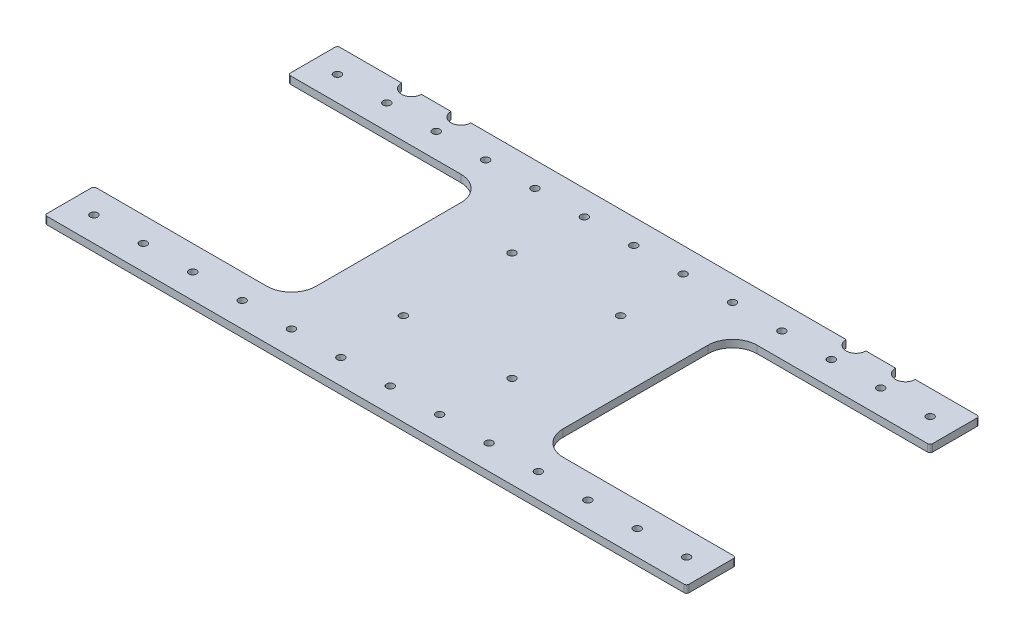
from build123d import *

# Parameters (mm, degrees)
EXTRUDE_1_DEPTH     = 3
CUT_EXTRUDE_START   = -10
CUT_EXTRUDE_1_DEPTH = 10
SKETCH_3_W          = 20
SKETCH_3_H          = 40
EXTRUDE_2_DEPTH     = 3
FILLET_2_R          = 1
FILLET_3_R          = 1
SKETCH_5_R          = 1.5
CUT_EXTRUDE_2_DEPTH = 10
SKETCH_6_R          = 1.5
CUT_EXTRUDE_3_DEPTH = 10
SKETCH_8_R          = 1.5
CUT_EXTRUDE_4_DEPTH = 234.216551728
SKETCH_10_R         = 4
CUT_EXTRUDE_6_DEPTH = 234.216551728
SKETCH_11_W         = 40.88
SKETCH_11_H         = 149.99999794
CUT_EXTRUDE_7_DEPTH = 10
SKETCH_12_W         = 75.865569995
SKETCH_12_H         = 55.877442545
CUT_EXTRUDE_8_DEPTH = 10


with BuildPart() as part:
    # 草图1 → 凸台-拉伸1 (new body)
    with BuildSketch(Plane(origin=(0, 0, 0), x_dir=(1, 0, 0), z_dir=(0, 1, 0))):
        with BuildLine():
            Line((-130, -193.6), (-50, -193.6))
            Line((-50, -193.6), (50, -193.6))
            Line((50, -193.6), (130, -193.6))
            Line((130, -193.6), (130, -173.6))
            Line((130, -173.6), (60, -173.6))
            ThreePointArc((60, -173.6), (52.928932188, -170.671067812), (50, -163.6))
            Line((50, -163.6), (50, -105))
            ThreePointArc((50, -105), (52.928932188, -97.928932188), (60, -95))
            Line((60, -95), (130, -95))
            Line((130, -95), (130, -75))
            Line((130, -75), (130, 75))
            Line((130, 75), (130, 95))
            Line((130, 95), (60, 95))
            ThreePointArc((60, 95), (52.928932188, 97.928932188), (50, 105))
            Line((50, 105), (50, 163.6))
            ThreePointArc((50, 163.6), (52.928932188, 170.671067812), (60, 173.6))
            Line((60, 173.6), (130, 173.6))
            Line((130, 173.6), (130, 193.6))
            Line((130, 193.6), (50, 193.6))
            Line((50, 193.6), (-50, 193.6))
            Line((-50, 193.6), (-130, 193.6))
            Line((-130, 193.6), (-130, 173.6))
            Line((-130, 173.6), (-60, 173.6))
            ThreePointArc((-60, 173.6), (-52.928932188, 170.671067812), (-50, 163.6))
            Line((-50, 163.6), (-50, 105))
            ThreePointArc((-50, 105), (-52.928932188, 97.928932188), (-60, 95))
            Line((-60, 95), (-130, 95))
            Line((-130, 95), (-130, 75))
            Line((-130, 75), (-130, -75))
            Line((-130, -75), (-130, -95))
            Line((-130, -95), (-60, -95))
            ThreePointArc((-60, -95), (-52.928932188, -97.928932188), (-50, -105))
            Line((-50, -105), (-50, -163.6))
            ThreePointArc((-50, -163.6), (-52.928932188, -170.671067812), (-60, -173.6))
            Line((-60, -173.6), (-130, -173.6))
            Line((-130, -173.6), (-130, -193.6))
        make_face()
    extrude(amount=EXTRUDE_1_DEPTH)

    # 草图2 → 切除-拉伸1 (cut)
    with BuildSketch(Plane(origin=(0, 3, 0), x_dir=(1, 0, 0), z_dir=(0, 1, 0)).offset(CUT_EXTRUDE_START)):
        with BuildLine():
            Line((-130, 95), (-130, -75))
            Line((-130, -75), (130, -75))
            Line((130, -75), (130, 95))
            Line((130, 95), (60, 95))
            ThreePointArc((60, 95), (52.928932188, 97.928932188), (50, 105))
            Line((50, 105), (50, 163.6))
            ThreePointArc((50, 163.6), (52.928932188, 170.671067812), (60, 173.6))
            Line((60, 173.6), (130, 173.6))
            Line((130, 173.6), (130, 193.6))
            Line((130, 193.6), (-130, 193.6))
            Line((-130, 193.6), (-130, 173.6))
            Line((-130, 173.6), (-60, 173.6))
            ThreePointArc((-60, 173.6), (-52.928932188, 170.671067812), (-50, 163.6))
            Line((-50, 163.6), (-50, 105))
            ThreePointArc((-50, 105), (-52.928932188, 97.928932188), (-60, 95))
            Line((-60, 95), (-130, 95))
        make_face()
    extrude(amount=CUT_EXTRUDE_1_DEPTH, mode=Mode.SUBTRACT)

    # 草图3 → 凸台-拉伸2 (add)
    with BuildSketch(Plane(origin=(0, 3, 0), x_dir=(1, 0, 0), z_dir=(0, 1, 0))):
        with Locations((90, -55)):
            Rectangle(SKETCH_3_W, SKETCH_3_H)
        with Locations((-90, -55)):
            Rectangle(SKETCH_3_W, SKETCH_3_H)
    extrude(amount=-EXTRUDE_2_DEPTH)

    # 圆角2
    fillet_2_edges = [part.edges().sort_by_distance(p)[0] for p in [
        (-130, 1.5, 75),
        (-100, 1.5, 35),
        (-80, 1.5, 35),
        (-130, 1.5, 193.6),
        (-130, 1.5, 173.6),
        (-130, 1.5, 95),
    ]]
    fillet(fillet_2_edges, radius=FILLET_2_R)

    # 圆角3
    fillet_3_edges = [part.edges().sort_by_distance(p)[0] for p in [
        (130, 1.5, 75),
        (80, 1.5, 35),
        (100, 1.5, 35),
        (130, 1.5, 95),
        (130, 1.5, 173.6),
        (130, 1.5, 193.6),
    ]]
    fillet(fillet_3_edges, radius=FILLET_3_R)

    # 草图5 → 切除-拉伸2 (cut)
    with BuildSketch(Plane(origin=(0, 3, 0), x_dir=(1, 0, 0), z_dir=(0, 1, 0))):
        with Locations(Location((22, -112.3, 0), (0, 0, 270))):
            Circle(SKETCH_5_R)
        with Locations(Location((-22, -112.3, 0), (0, 0, 270))):
            Circle(SKETCH_5_R)
        with Locations(Location((-22, -156.3, 0), (0, 0, 270))):
            Circle(SKETCH_5_R)
        with Locations(Location((22, -156.3, 0), (0, 0, 270))):
            Circle(SKETCH_5_R)
    extrude(amount=-CUT_EXTRUDE_2_DEPTH, mode=Mode.SUBTRACT)

    # 草图6 → 切除-拉伸3 (cut)
    with BuildSketch(Plane(origin=(0, 3, 0), x_dir=(1, 0, 0), z_dir=(0, 1, 0))):
        with Locations(Location((120, -85, 0), (0, 0, 270))):
            Circle(SKETCH_6_R)
        with Locations(Location((80, -85, 0), (0, 0, 270))):
            Circle(SKETCH_6_R)
        with Locations(Location((100, -85, 0), (0, 0, 270))):
            Circle(SKETCH_6_R)
        with Locations(Location((60, -85, 0), (0, 0, 270))):
            Circle(SKETCH_6_R)
        with Locations(Location((40, -85, 0), (0, 0, 270))):
            Circle(SKETCH_6_R)
        with Locations(Location((20, -85, 0), (0, 0, 270))):
            Circle(SKETCH_6_R)
        with Locations(Location((0, -85, 0), (0, 0, 270))):
            Circle(SKETCH_6_R)
        with Locations(Location((-20, -85, 0), (0, 0, 270))):
            Circle(SKETCH_6_R)
        with Locations(Location((-40, -85, 0), (0, 0, 270))):
            Circle(SKETCH_6_R)
        with Locations(Location((-60, -85, 0), (0, 0, 270))):
            Circle(SKETCH_6_R)
        with Locations(Location((-80, -85, 0), (0, 0, 270))):
            Circle(SKETCH_6_R)
        with Locations(Location((-100, -85, 0), (0, 0, 270))):
            Circle(SKETCH_6_R)
        with Locations(Location((-120, -85, 0), (0, 0, 270))):
            Circle(SKETCH_6_R)
        with Locations(Location((-100, -183.6, 0), (0, 0, 270))):
            Circle(SKETCH_6_R)
        with Locations(Location((-120, -183.6, 0), (0, 0, 270))):
            Circle(SKETCH_6_R)
        with Locations(Location((-80, -183.6, 0), (0, 0, 270))):
            Circle(SKETCH_6_R)
        with Locations(Location((-60, -183.6, 0), (0, 0, 270))):
            Circle(SKETCH_6_R)
        with Locations(Location((-40, -183.6, 0), (0, 0, 270))):
            Circle(SKETCH_6_R)
        with Locations(Location((-20, -183.6, 0), (0, 0, 270))):
            Circle(SKETCH_6_R)
        with Locations(Location((0, -183.6, 0), (0, 0, 270))):
            Circle(SKETCH_6_R)
        with Locations(Location((20, -183.6, 0), (0, 0, 270))):
            Circle(SKETCH_6_R)
        with Locations(Location((40, -183.6, 0), (0, 0, 270))):
            Circle(SKETCH_6_R)
        with Locations(Location((60, -183.6, 0), (0, 0, 270))):
            Circle(SKETCH_6_R)
        with Locations(Location((80, -183.6, 0), (0, 0, 270))):
            Circle(SKETCH_6_R)
        with Locations(Location((100, -183.6, 0), (0, 0, 270))):
            Circle(SKETCH_6_R)
        with Locations(Location((120, -183.6, 0), (0, 0, 270))):
            Circle(SKETCH_6_R)
    extrude(amount=-CUT_EXTRUDE_3_DEPTH, mode=Mode.SUBTRACT)

    # 草图8 → 切除-拉伸4 (cut, through all)
    with BuildSketch(Plane.XZ):
        with Locations(Location((-90, 40, 0), (0, 0, 270))):
            Circle(SKETCH_8_R)
        with Locations(Location((-90, 60, 0), (0, 0, 270))):
            Circle(SKETCH_8_R)
        with Locations(Location((90, 60, 0), (0, 0, 270))):
            Circle(SKETCH_8_R)
        with Locations(Location((90, 40, 0), (0, 0, 270))):
            Circle(SKETCH_8_R)
    extrude(amount=-CUT_EXTRUDE_4_DEPTH, mode=Mode.SUBTRACT)

    # 草图10 → 切除-拉伸6 (cut, through all)
    with BuildSketch(Plane(origin=(0, 3, 0), x_dir=(1, 0, 0), z_dir=(0, 1, 0))):
        with Locations((-100, -75)):
            Circle(SKETCH_10_R)
        with Locations((-80, -75)):
            Circle(SKETCH_10_R)
        with Locations((80, -75)):
            Circle(SKETCH_10_R)
        with Locations((100, -75)):
            Circle(SKETCH_10_R)
    extrude(amount=-CUT_EXTRUDE_6_DEPTH, mode=Mode.SUBTRACT)

    # 草图11 → 切除-拉伸7 (cut)
    with BuildSketch(Plane(origin=(0, 3, 0), x_dir=(1, 0, 0), z_dir=(0, 1, 0))):
        with Locations((-98.325151621, -1.03e-06)):
            Rectangle(SKETCH_11_W, SKETCH_11_H)
    extrude(amount=-CUT_EXTRUDE_7_DEPTH, mode=Mode.SUBTRACT)

    # 草图12 → 切除-拉伸8 (cut)
    with BuildSketch(Plane(origin=(0, 3, 0), x_dir=(1, 0, 0), z_dir=(0, 1, 0))):
        with Locations((78.567215003, -47.061278728)):
            Rectangle(SKETCH_12_W, SKETCH_12_H)
    extrude(amount=-CUT_EXTRUDE_8_DEPTH, mode=Mode.SUBTRACT)


solid = part.part
